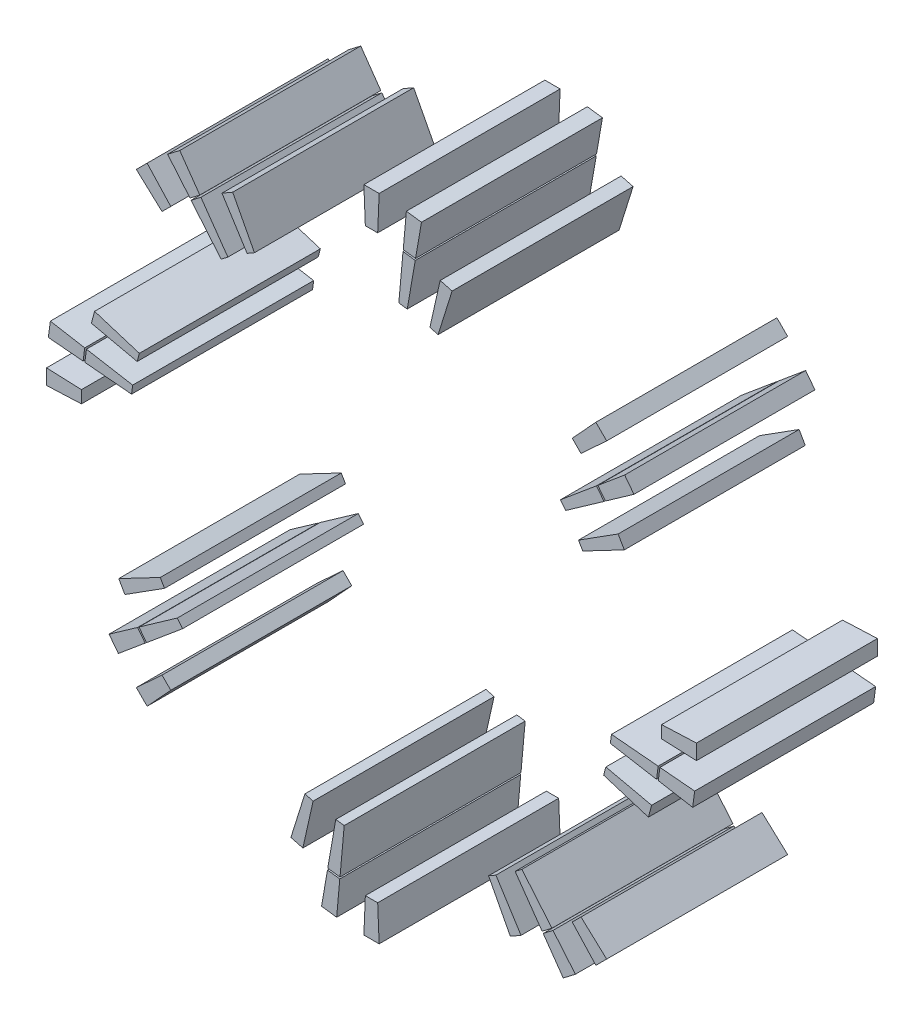
from build123d import *

# Parameters (mm, degrees)
SLOT_COPPER_ENVELOPES_START    = -20
SLOT_COPPER_ENVELOPES_DEPTH    = 40
SLOT_COPPER_ENVELOPES_2_DEPTH  = 40
SLOT_COPPER_ENVELOPES_3_DEPTH  = 40
SLOT_COPPER_ENVELOPES_4_DEPTH  = 40
SLOT_COPPER_ENVELOPES_5_DEPTH  = 40
SLOT_COPPER_ENVELOPES_6_DEPTH  = 40
SLOT_COPPER_ENVELOPES_7_DEPTH  = 40
SLOT_COPPER_ENVELOPES_8_DEPTH  = 40
SLOT_COPPER_ENVELOPES_9_DEPTH  = 40
SLOT_COPPER_ENVELOPES_10_DEPTH = 40
SLOT_COPPER_ENVELOPES_11_DEPTH = 40
SLOT_COPPER_ENVELOPES_12_DEPTH = 40
SLOT_COPPER_ENVELOPES_13_DEPTH = 40
SLOT_COPPER_ENVELOPES_14_DEPTH = 40
SLOT_COPPER_ENVELOPES_15_DEPTH = 40
SLOT_COPPER_ENVELOPES_16_DEPTH = 40
SLOT_COPPER_ENVELOPES_17_DEPTH = 40
SLOT_COPPER_ENVELOPES_18_DEPTH = 40
SLOT_COPPER_ENVELOPES_19_DEPTH = 40
SLOT_COPPER_ENVELOPES_20_DEPTH = 40
SLOT_COPPER_ENVELOPES_21_DEPTH = 40
SLOT_COPPER_ENVELOPES_22_DEPTH = 40
SLOT_COPPER_ENVELOPES_23_DEPTH = 40
SLOT_COPPER_ENVELOPES_24_DEPTH = 40
SLOT_COPPER_ENVELOPES_25_DEPTH = 40
SLOT_COPPER_ENVELOPES_26_DEPTH = 40
SLOT_COPPER_ENVELOPES_27_DEPTH = 40
SLOT_COPPER_ENVELOPES_28_DEPTH = 40
SLOT_COPPER_ENVELOPES_29_DEPTH = 40
SLOT_COPPER_ENVELOPES_30_DEPTH = 40
SLOT_COPPER_ENVELOPES_31_DEPTH = 40
SLOT_COPPER_ENVELOPES_32_DEPTH = 40


with BuildPart() as part:
    # Эскиз1 → Slot_copper_envelopes (new body)
    with BuildSketch(Plane.XY.offset(SLOT_COPPER_ENVELOPES_START)):
        Polygon((64.10855161, -1.364772727), (71.815384615, -1.6875), (71.815384615, 1.6875), (64.10855161, 1.364772727), align=None)
    extrude(amount=SLOT_COPPER_ENVELOPES_DEPTH)


with BuildPart() as body_2:
    # Эскиз1 → Slot_copper_envelopes 2 (new body)
    with BuildSketch(Plane.XY.offset(SLOT_COPPER_ENVELOPES_START)):
        Polygon((46.687390808, 25.872445896), (55.868189786, 30.679610609), (54.503417059, 33.043466314), (45.749890808, 27.496243528), align=None)
    extrude(amount=SLOT_COPPER_ENVELOPES_2_DEPTH)


with BuildPart() as body_3:
    # Эскиз1 → Slot_copper_envelopes 3 (new body)
    with BuildSketch(Plane.XY.offset(SLOT_COPPER_ENVELOPES_START)):
        Polygon((51.691554556, 37.944066488), (58.00226018, 42.379652402), (55.947690357, 45.057219925), (50.029912565, 40.109560491), align=None)
    extrude(amount=SLOT_COPPER_ENVELOPES_3_DEPTH)


with BuildPart() as body_4:
    # Эскиз1 → Slot_copper_envelopes 4 (new body)
    with BuildSketch(Plane.XY.offset(SLOT_COPPER_ENVELOPES_START)):
        Polygon((42.910941862, 31.745030882), (51.385736926, 37.709404367), (49.724094935, 39.87489837), (41.769514182, 33.232568395), align=None)
    extrude(amount=SLOT_COPPER_ENVELOPES_4_DEPTH)


with BuildPart() as body_5:
    # Эскиз1 → Slot_copper_envelopes 5 (new body)
    with BuildSketch(Plane.XY.offset(SLOT_COPPER_ENVELOPES_START)):
        Polygon((46.296631625, 44.366551525), (51.974388148, 49.587902762), (49.587902762, 51.974388148), (44.366551525, 46.296631625), align=None)
    extrude(amount=SLOT_COPPER_ENVELOPES_5_DEPTH)


with BuildPart() as body_6:
    # Эскиз1 → Slot_copper_envelopes 6 (new body)
    with BuildSketch(Plane.XY.offset(SLOT_COPPER_ENVELOPES_START)):
        Polygon((14.718388697, 51.307552576), (17.811015145, 61.198536557), (15.174476696, 61.904994905), (12.907277773, 51.792838285), align=None)
    extrude(amount=SLOT_COPPER_ENVELOPES_6_DEPTH)


with BuildPart() as body_7:
    # Эскиз1 → Slot_copper_envelopes 7 (new body)
    with BuildSketch(Plane.XY.offset(SLOT_COPPER_ENVELOPES_START)):
        Polygon((9.720942038, 63.381955476), (11.0468519, 70.980731095), (7.700725493, 71.421256994), (7.014748223, 63.738232651), align=None)
    extrude(amount=SLOT_COPPER_ENVELOPES_7_DEPTH)


with BuildPart() as body_8:
    # Эскиз1 → Slot_copper_envelopes 8 (new body)
    with BuildSketch(Plane.XY.offset(SLOT_COPPER_ENVELOPES_START)):
        Polygon((7.895491372, 52.789744583), (9.670627495, 62.999778579), (6.96443368, 63.356055754), (6.036532257, 53.034481194), align=None)
    extrude(amount=SLOT_COPPER_ENVELOPES_8_DEPTH)


with BuildPart() as body_9:
    # Эскиз1 → Slot_copper_envelopes 9 (new body)
    with BuildSketch(Plane.XY.offset(SLOT_COPPER_ENVELOPES_START)):
        Polygon((1.364772727, 64.10855161), (1.6875, 71.815384615), (-1.6875, 71.815384615), (-1.364772727, 64.10855161), align=None)
    extrude(amount=SLOT_COPPER_ENVELOPES_9_DEPTH)


with BuildPart() as body_10:
    # Эскиз1 → Slot_copper_envelopes 10 (new body)
    with BuildSketch(Plane.XY.offset(SLOT_COPPER_ENVELOPES_START)):
        Polygon((-25.872445896, 46.687390808), (-30.679610609, 55.868189786), (-33.043466314, 54.503417059), (-27.496243528, 45.749890808), align=None)
    extrude(amount=SLOT_COPPER_ENVELOPES_10_DEPTH)


with BuildPart() as body_11:
    # Эскиз1 → Slot_copper_envelopes 11 (new body)
    with BuildSketch(Plane.XY.offset(SLOT_COPPER_ENVELOPES_START)):
        Polygon((-37.944066488, 51.691554556), (-42.379652402, 58.00226018), (-45.057219925, 55.947690357), (-40.109560491, 50.029912565), align=None)
    extrude(amount=SLOT_COPPER_ENVELOPES_11_DEPTH)


with BuildPart() as body_12:
    # Эскиз1 → Slot_copper_envelopes 12 (new body)
    with BuildSketch(Plane.XY.offset(SLOT_COPPER_ENVELOPES_START)):
        Polygon((-31.745030882, 42.910941862), (-37.709404367, 51.385736926), (-39.87489837, 49.724094935), (-33.232568395, 41.769514182), align=None)
    extrude(amount=SLOT_COPPER_ENVELOPES_12_DEPTH)


with BuildPart() as body_13:
    # Эскиз1 → Slot_copper_envelopes 13 (new body)
    with BuildSketch(Plane.XY.offset(SLOT_COPPER_ENVELOPES_START)):
        Polygon((-44.366551525, 46.296631625), (-49.587902762, 51.974388148), (-51.974388148, 49.587902762), (-46.296631625, 44.366551525), align=None)
    extrude(amount=SLOT_COPPER_ENVELOPES_13_DEPTH)


with BuildPart() as body_14:
    # Эскиз1 → Slot_copper_envelopes 14 (new body)
    with BuildSketch(Plane.XY.offset(SLOT_COPPER_ENVELOPES_START)):
        Polygon((-51.307552576, 14.718388697), (-61.198536557, 17.811015145), (-61.904994905, 15.174476696), (-51.792838285, 12.907277773), align=None)
    extrude(amount=SLOT_COPPER_ENVELOPES_14_DEPTH)


with BuildPart() as body_15:
    # Эскиз1 → Slot_copper_envelopes 15 (new body)
    with BuildSketch(Plane.XY.offset(SLOT_COPPER_ENVELOPES_START)):
        Polygon((-63.381955476, 9.720942038), (-70.980731095, 11.0468519), (-71.421256994, 7.700725493), (-63.738232651, 7.014748223), align=None)
    extrude(amount=SLOT_COPPER_ENVELOPES_15_DEPTH)


with BuildPart() as body_16:
    # Эскиз1 → Slot_copper_envelopes 16 (new body)
    with BuildSketch(Plane.XY.offset(SLOT_COPPER_ENVELOPES_START)):
        Polygon((-52.789744583, 7.895491372), (-62.999778579, 9.670627495), (-63.356055754, 6.96443368), (-53.034481194, 6.036532257), align=None)
    extrude(amount=SLOT_COPPER_ENVELOPES_16_DEPTH)


with BuildPart() as body_17:
    # Эскиз1 → Slot_copper_envelopes 17 (new body)
    with BuildSketch(Plane.XY.offset(SLOT_COPPER_ENVELOPES_START)):
        Polygon((-64.10855161, 1.364772727), (-71.815384615, 1.6875), (-71.815384615, -1.6875), (-64.10855161, -1.364772727), align=None)
    extrude(amount=SLOT_COPPER_ENVELOPES_17_DEPTH)


with BuildPart() as body_18:
    # Эскиз1 → Slot_copper_envelopes 18 (new body)
    with BuildSketch(Plane.XY.offset(SLOT_COPPER_ENVELOPES_START)):
        Polygon((-46.687390808, -25.872445896), (-55.868189786, -30.679610609), (-54.503417059, -33.043466314), (-45.749890808, -27.496243528), align=None)
    extrude(amount=SLOT_COPPER_ENVELOPES_18_DEPTH)


with BuildPart() as body_19:
    # Эскиз1 → Slot_copper_envelopes 19 (new body)
    with BuildSketch(Plane.XY.offset(SLOT_COPPER_ENVELOPES_START)):
        Polygon((-51.691554556, -37.944066488), (-58.00226018, -42.379652402), (-55.947690357, -45.057219925), (-50.029912565, -40.109560491), align=None)
    extrude(amount=SLOT_COPPER_ENVELOPES_19_DEPTH)


with BuildPart() as body_20:
    # Эскиз1 → Slot_copper_envelopes 20 (new body)
    with BuildSketch(Plane.XY.offset(SLOT_COPPER_ENVELOPES_START)):
        Polygon((-42.910941862, -31.745030882), (-51.385736926, -37.709404367), (-49.724094935, -39.87489837), (-41.769514182, -33.232568395), align=None)
    extrude(amount=SLOT_COPPER_ENVELOPES_20_DEPTH)


with BuildPart() as body_21:
    # Эскиз1 → Slot_copper_envelopes 21 (new body)
    with BuildSketch(Plane.XY.offset(SLOT_COPPER_ENVELOPES_START)):
        Polygon((-46.296631625, -44.366551525), (-51.974388148, -49.587902762), (-49.587902762, -51.974388148), (-44.366551525, -46.296631625), align=None)
    extrude(amount=SLOT_COPPER_ENVELOPES_21_DEPTH)


with BuildPart() as body_22:
    # Эскиз1 → Slot_copper_envelopes 22 (new body)
    with BuildSketch(Plane.XY.offset(SLOT_COPPER_ENVELOPES_START)):
        Polygon((-14.718388697, -51.307552576), (-17.811015145, -61.198536557), (-15.174476696, -61.904994905), (-12.907277773, -51.792838285), align=None)
    extrude(amount=SLOT_COPPER_ENVELOPES_22_DEPTH)


with BuildPart() as body_23:
    # Эскиз1 → Slot_copper_envelopes 23 (new body)
    with BuildSketch(Plane.XY.offset(SLOT_COPPER_ENVELOPES_START)):
        Polygon((-9.720942038, -63.381955476), (-11.0468519, -70.980731095), (-7.700725493, -71.421256994), (-7.014748223, -63.738232651), align=None)
    extrude(amount=SLOT_COPPER_ENVELOPES_23_DEPTH)


with BuildPart() as body_24:
    # Эскиз1 → Slot_copper_envelopes 24 (new body)
    with BuildSketch(Plane.XY.offset(SLOT_COPPER_ENVELOPES_START)):
        Polygon((-7.895491372, -52.789744583), (-9.670627495, -62.999778579), (-6.96443368, -63.356055754), (-6.036532257, -53.034481194), align=None)
    extrude(amount=SLOT_COPPER_ENVELOPES_24_DEPTH)


with BuildPart() as body_25:
    # Эскиз1 → Slot_copper_envelopes 25 (new body)
    with BuildSketch(Plane.XY.offset(SLOT_COPPER_ENVELOPES_START)):
        Polygon((-1.364772727, -64.10855161), (-1.6875, -71.815384615), (1.6875, -71.815384615), (1.364772727, -64.10855161), align=None)
    extrude(amount=SLOT_COPPER_ENVELOPES_25_DEPTH)


with BuildPart() as body_26:
    # Эскиз1 → Slot_copper_envelopes 26 (new body)
    with BuildSketch(Plane.XY.offset(SLOT_COPPER_ENVELOPES_START)):
        Polygon((25.872445896, -46.687390808), (30.679610609, -55.868189786), (33.043466314, -54.503417059), (27.496243528, -45.749890808), align=None)
    extrude(amount=SLOT_COPPER_ENVELOPES_26_DEPTH)


with BuildPart() as body_27:
    # Эскиз1 → Slot_copper_envelopes 27 (new body)
    with BuildSketch(Plane.XY.offset(SLOT_COPPER_ENVELOPES_START)):
        Polygon((37.944066488, -51.691554556), (42.379652402, -58.00226018), (45.057219925, -55.947690357), (40.109560491, -50.029912565), align=None)
    extrude(amount=SLOT_COPPER_ENVELOPES_27_DEPTH)


with BuildPart() as body_28:
    # Эскиз1 → Slot_copper_envelopes 28 (new body)
    with BuildSketch(Plane.XY.offset(SLOT_COPPER_ENVELOPES_START)):
        Polygon((31.745030882, -42.910941862), (37.709404367, -51.385736926), (39.87489837, -49.724094935), (33.232568395, -41.769514182), align=None)
    extrude(amount=SLOT_COPPER_ENVELOPES_28_DEPTH)


with BuildPart() as body_29:
    # Эскиз1 → Slot_copper_envelopes 29 (new body)
    with BuildSketch(Plane.XY.offset(SLOT_COPPER_ENVELOPES_START)):
        Polygon((44.366551525, -46.296631625), (49.587902762, -51.974388148), (51.974388148, -49.587902762), (46.296631625, -44.366551525), align=None)
    extrude(amount=SLOT_COPPER_ENVELOPES_29_DEPTH)


with BuildPart() as body_30:
    # Эскиз1 → Slot_copper_envelopes 30 (new body)
    with BuildSketch(Plane.XY.offset(SLOT_COPPER_ENVELOPES_START)):
        Polygon((51.307552576, -14.718388697), (61.198536557, -17.811015145), (61.904994905, -15.174476696), (51.792838285, -12.907277773), align=None)
    extrude(amount=SLOT_COPPER_ENVELOPES_30_DEPTH)


with BuildPart() as body_31:
    # Эскиз1 → Slot_copper_envelopes 31 (new body)
    with BuildSketch(Plane.XY.offset(SLOT_COPPER_ENVELOPES_START)):
        Polygon((63.381955476, -9.720942038), (70.980731095, -11.0468519), (71.421256994, -7.700725493), (63.738232651, -7.014748223), align=None)
    extrude(amount=SLOT_COPPER_ENVELOPES_31_DEPTH)


with BuildPart() as body_32:
    # Эскиз1 → Slot_copper_envelopes 32 (new body)
    with BuildSketch(Plane.XY.offset(SLOT_COPPER_ENVELOPES_START)):
        Polygon((52.789744583, -7.895491372), (62.999778579, -9.670627495), (63.356055754, -6.96443368), (53.034481194, -6.036532257), align=None)
    extrude(amount=SLOT_COPPER_ENVELOPES_32_DEPTH)


solid = Compound([part.part, body_2.part, body_3.part, body_4.part, body_5.part, body_6.part, body_7.part, body_8.part, body_9.part, body_10.part, body_11.part, body_12.part, body_13.part, body_14.part, body_15.part, body_16.part, body_17.part, body_18.part, body_19.part, body_20.part, body_21.part, body_22.part, body_23.part, body_24.part, body_25.part, body_26.part, body_27.part, body_28.part, body_29.part, body_30.part, body_31.part, body_32.part])
